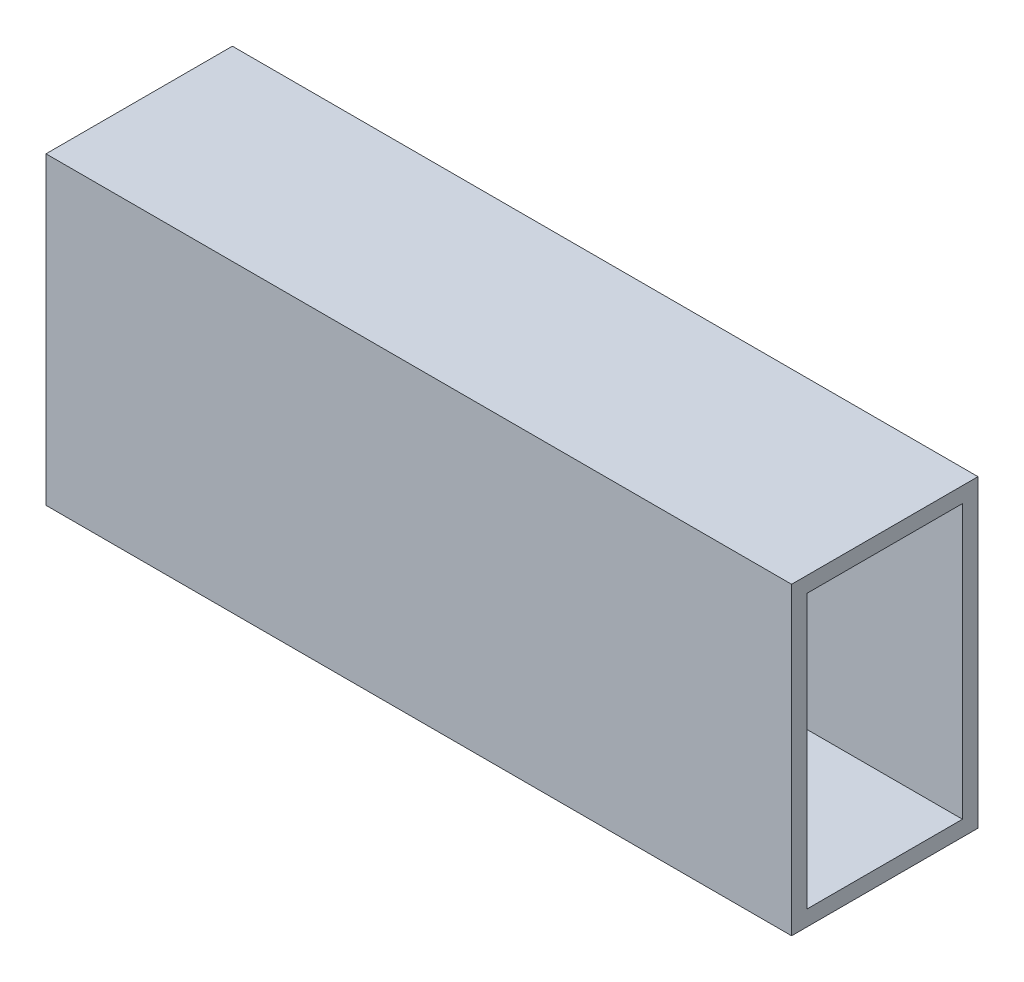
from build123d import *

# Parameters (mm, degrees)
SKETCH1_W           = 240
SKETCH1_H           = 60
BOSS_EXTRUDE1_DEPTH = 5
BOSS_EXTRUDE2_DEPTH = 88
BOSS_EXTRUDE3_START = 93
SKETCH1_2_W         = 240
SKETCH1_2_H         = 60
BOSS_EXTRUDE3_DEPTH = 5


with BuildPart() as part:
    # Sketch1 → Boss-Extrude1 (new body)
    with BuildSketch(Plane(origin=(0, 0, 0), x_dir=(1, 0, 0), z_dir=(0, 1, 0))):
        Rectangle(SKETCH1_W, SKETCH1_H)
    extrude(amount=BOSS_EXTRUDE1_DEPTH)

    # Sketch2 → Boss-Extrude2 (add)
    with BuildSketch(Plane(origin=(0, 5, 0), x_dir=(1, 0, 0), z_dir=(0, 1, 0))):
        Polygon((-120, 30), (-120, -30), (120, -30), (120, -25), (-115, -25), (-115, 25), (120, 25), (120, 30), align=None)
    extrude(amount=BOSS_EXTRUDE2_DEPTH)

    # Sketch1<2> → Boss-Extrude3 (add)
    with BuildSketch(Plane(origin=(0, 0, 0), x_dir=(1, 0, 0), z_dir=(0, 1, 0)).offset(BOSS_EXTRUDE3_START)):
        Rectangle(SKETCH1_2_W, SKETCH1_2_H)
    extrude(amount=BOSS_EXTRUDE3_DEPTH)


solid = part.part
